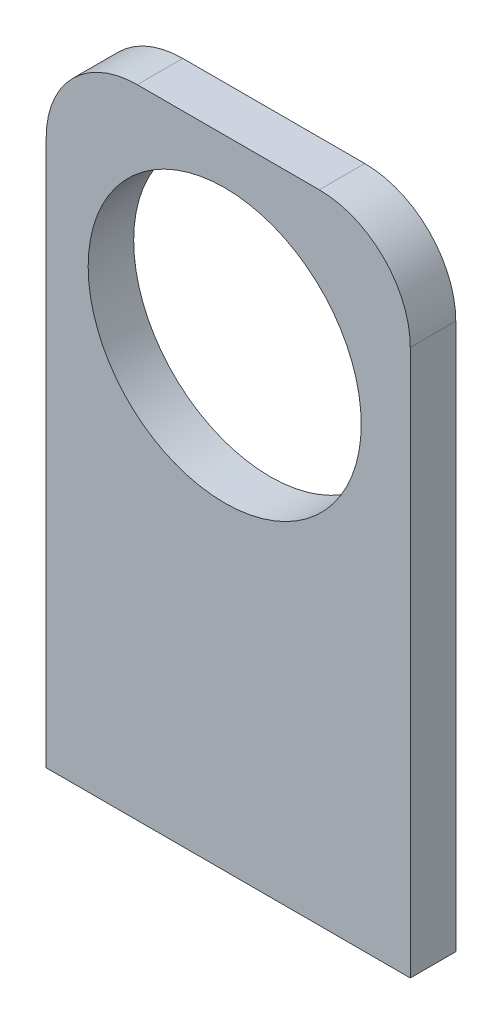
from build123d import *

# Parameters (mm, degrees)
SKETCH1_W           = 25.4
SKETCH1_H           = 44.45
SKETCH1_R           = 9.525
BOSS_EXTRUDE1_DEPTH = 3.175
FILLET1_R           = 6.35


with BuildPart() as part:
    # Sketch1 → Boss-Extrude1 (new body)
    with BuildSketch(Plane.XY):
        with Locations((12.282474227, -21.155412371)):
            Rectangle(SKETCH1_W, SKETCH1_H)
        with Locations((12.035016268, -11.630412371)):
            Circle(SKETCH1_R, mode=Mode.SUBTRACT)
    extrude(amount=BOSS_EXTRUDE1_DEPTH)

    # Fillet1
    fillet1_edges = [part.edges().sort_by_distance(p)[0] for p in [
        (-0.417525773, 1.069587629, 1.5875),
        (24.982474227, 1.069587629, 1.5875),
    ]]
    fillet(fillet1_edges, radius=FILLET1_R)


solid = part.part
